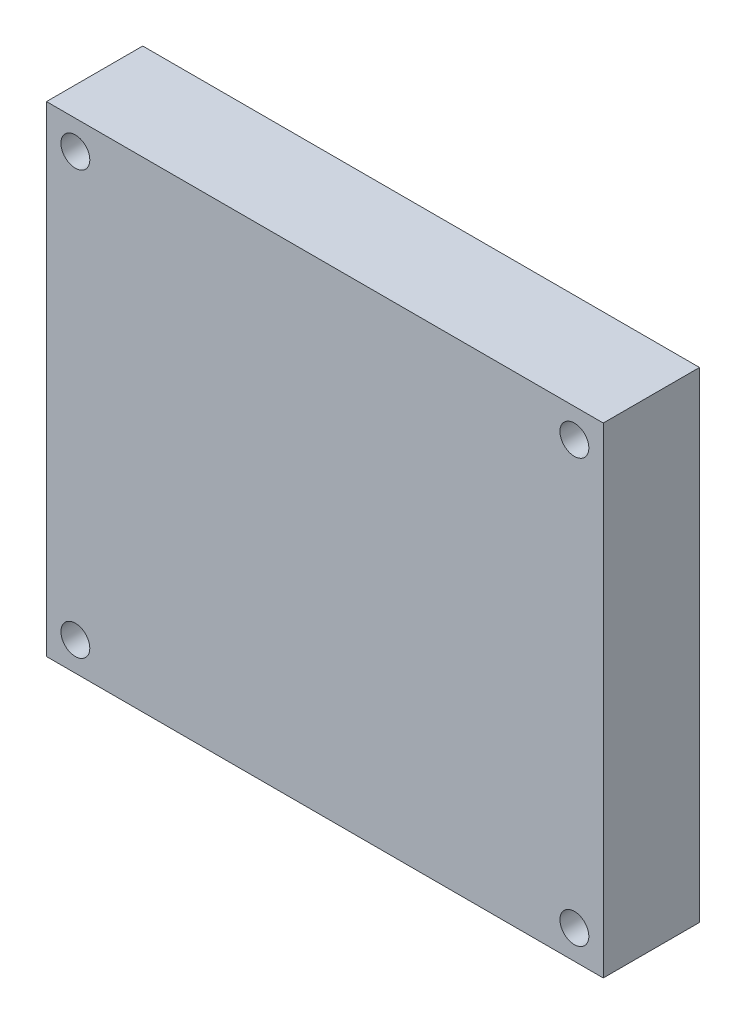
from build123d import *

# Parameters (mm, degrees)
SKETCH_1_W      = 57.849
SKETCH_1_H      = 49.936
SKETCH_1_R      = 1.5
EXTRUDE_1_DEPTH = 10


with BuildPart() as part:
    # 草图1 → 凸台-拉伸1 (new body)
    with BuildSketch(Plane.XY):
        with Locations((25.9245, -21.968)):
            Rectangle(SKETCH_1_W, SKETCH_1_H)
        Circle(SKETCH_1_R, mode=Mode.SUBTRACT)
        with Locations((51.849, 0)):
            Circle(SKETCH_1_R, mode=Mode.SUBTRACT)
        with Locations((51.849, -43.936)):
            Circle(SKETCH_1_R, mode=Mode.SUBTRACT)
        with Locations((0, -43.936)):
            Circle(SKETCH_1_R, mode=Mode.SUBTRACT)
    extrude(amount=EXTRUDE_1_DEPTH)


solid = part.part
